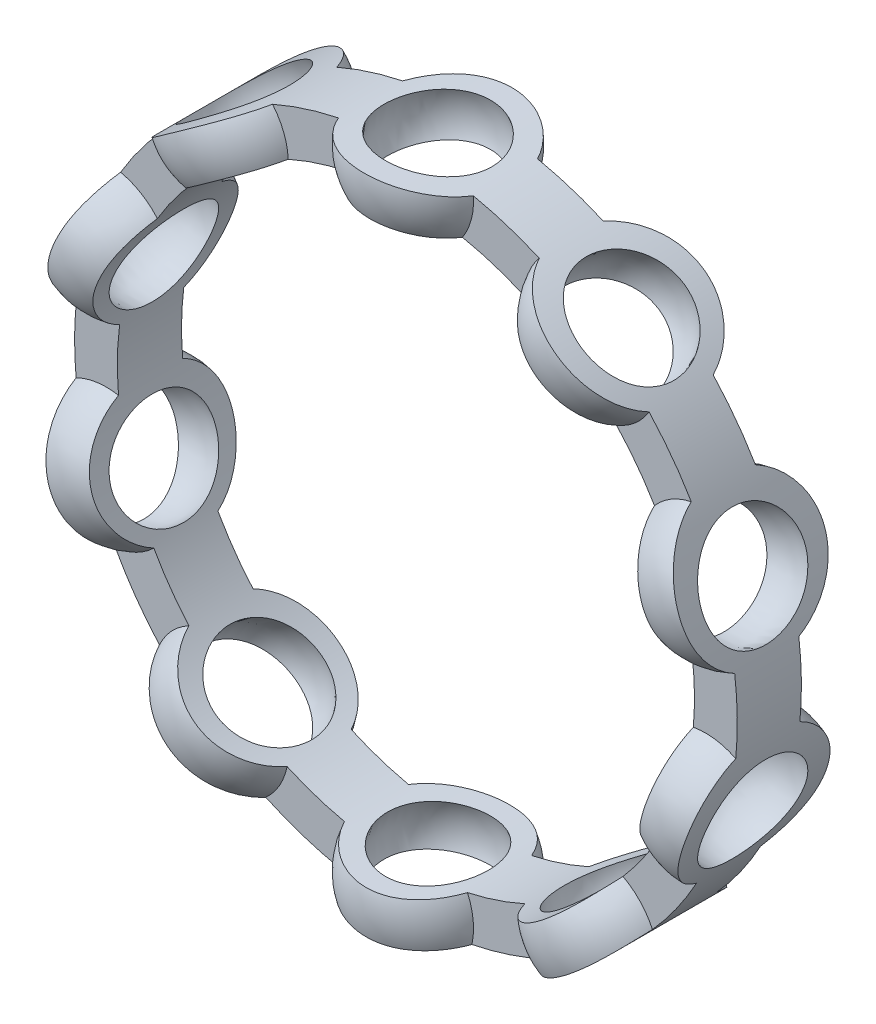
from build123d import *

# Parameters (mm, degrees)
SKETCH_1_R               = 12.5
EXTRUDE_1_DEPTH          = 0.75
PATTERN_CIRCULAR_1_COUNT = 10
SKETCH_3_OUTSIDE_W       = 34.106
SKETCH_3_OUTSIDE_H       = 34.106
SKETCH_3_OUTSIDE_R       = 7.75
SKETCH_3_OUTSIDE_R_2     = 6.75
CUT_EXTRUDE_1_DEPTH      = 5
PATTERN_CIRCULAR_2_COUNT = 10


with BuildPart() as part:
    # 草图1 → 凸台-拉伸1 (new, symmetric)
    with BuildSketch(Plane.XY):
        Circle(SKETCH_1_R)
    extrude(amount=EXTRUDE_1_DEPTH, both=True)

    # 草图2 → 旋转1 (revolve)
    with BuildSketch(Plane(origin=(0, 0, 0), x_dir=(0, 0, -1), z_dir=(1, 0, 0))):
        with BuildLine():
            Line((-1.75, -7.25), (1.75, -7.25))
            ThreePointArc((1.75, -7.25), (0, -9), (-1.75, -7.25))
        make_face()
    revolve_1 = revolve(axis=Axis((0, -7.25, 1.75), (0, 0, -1)))

    # 阵列(圆周)1: 旋转1 ×10 about axis
    pattern_circular_1_axis = Axis((0, 0.117886179, 0), (0, 0, 1))
    for i in range(1, PATTERN_CIRCULAR_1_COUNT):
        add(revolve_1.rotate(pattern_circular_1_axis, i * 360 / PATTERN_CIRCULAR_1_COUNT))

    # 草图3 outside → 切除-拉伸1 (cut, symmetric)
    # profile 1 of 2: a face of its own
    with BuildSketch(Plane(origin=(0, 0, -0.75), x_dir=(-1, 0, 0), z_dir=(0, 0, -1))):
        Rectangle(SKETCH_3_OUTSIDE_W, SKETCH_3_OUTSIDE_H)
        with Locations(Location((0, 0, 0), (0, 0, 354.486774205))):
            Circle(SKETCH_3_OUTSIDE_R, mode=Mode.SUBTRACT)
    # profile 2 of 2: a face of its own
    with BuildSketch(Plane(origin=(0, 0, -0.75), x_dir=(-1, 0, 0), z_dir=(0, 0, -1))):
        with Locations(Location((0, 0, 0), (0, 0, 354.870065315))):
            Circle(SKETCH_3_OUTSIDE_R_2)
    extrude(amount=CUT_EXTRUDE_1_DEPTH, both=True, mode=Mode.SUBTRACT)

    # 草图7 → 切除-旋转3 (revolve, cut)
    with BuildSketch(Plane(origin=(0, 0, 0), x_dir=(0, 0, -1), z_dir=(1, 0, 0))):
        with BuildLine():
            Line((-1.325, -7.25), (1.325, -7.25))
            ThreePointArc((1.325, -7.25), (0, -8.575), (-1.325, -7.25))
        make_face()
    cut_revolve_3 = revolve(axis=Axis((0, -7.25, 1.325), (0, 0, -1)), mode=Mode.SUBTRACT)

    # 阵列(圆周)2: 切除-旋转3 ×10 about axis
    pattern_circular_2_axis = Axis((0, 0, 0), (0, 0, 1))
    for i in range(1, PATTERN_CIRCULAR_2_COUNT):
        add(cut_revolve_3.rotate(pattern_circular_2_axis, i * 360 / PATTERN_CIRCULAR_2_COUNT), mode=Mode.SUBTRACT)


solid = part.part
